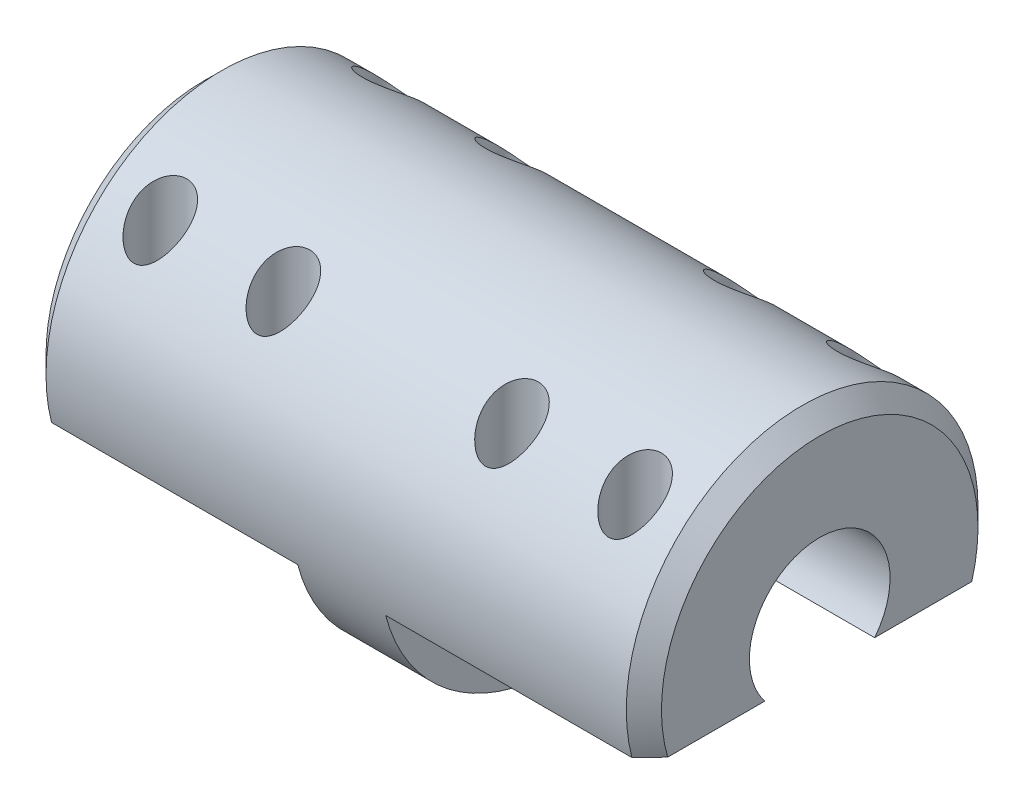
from build123d import *

# Parameters (mm, degrees)
SKETCH_1_R          = 10
SKETCH_1_R_2        = 4
EXTRUDE_1_DEPTH     = 35
CHAMFER_1_SIZE      = 1
SKETCH_3_W          = 15
SKETCH_3_H          = 20
CUT_EXTRUDE_1_DEPTH = 7.5
SKETCH_3_4_R        = 1.5
CUT_EXTRUDE_2_DEPTH = 42.533119315


with BuildPart() as part:
    # 草图1 → 凸台-拉伸1 (new body)
    with BuildSketch(Plane(origin=(0, 0, 0), x_dir=(0, 0, -1), z_dir=(1, 0, 0))):
        Circle(SKETCH_1_R)
        Circle(SKETCH_1_R_2, mode=Mode.SUBTRACT)
    extrude(amount=EXTRUDE_1_DEPTH)

    # 倒角1
    chamfer_1_edges = [part.edges().sort_by_distance(p)[0] for p in [
        (35, 0, 10),
        (0, 0, 10),
    ]]
    chamfer(chamfer_1_edges, length=CHAMFER_1_SIZE)

    # 草图3 → 切除-拉伸1 (cut)
    with BuildSketch(Plane(origin=(0, -10, 0), x_dir=(-1, 0, 0), z_dir=(0, -1, 0))):
        with Locations((-7.5, 0)):
            Rectangle(SKETCH_3_W, SKETCH_3_H)
        with Locations((-27.5, 0)):
            Rectangle(SKETCH_3_W, SKETCH_3_H)
    extrude(amount=-CUT_EXTRUDE_1_DEPTH, mode=Mode.SUBTRACT)

    # 草图3<4> → 切除-拉伸2 (cut, through all)
    with BuildSketch(Plane(origin=(0, -10, 0), x_dir=(-1, 0, 0), z_dir=(0, -1, 0))):
        with Locations((-4, 6.5)):
            Circle(SKETCH_3_4_R)
        with Locations((-11, 6.5)):
            Circle(SKETCH_3_4_R)
        with Locations((-11, -6.5)):
            Circle(SKETCH_3_4_R)
        with Locations((-4, -6.5)):
            Circle(SKETCH_3_4_R)
        with Locations((-31, -6.5)):
            Circle(SKETCH_3_4_R)
        with Locations((-24, -6.5)):
            Circle(SKETCH_3_4_R)
        with Locations((-24, 6.5)):
            Circle(SKETCH_3_4_R)
        with Locations((-31, 6.5)):
            Circle(SKETCH_3_4_R)
    extrude(amount=-CUT_EXTRUDE_2_DEPTH, mode=Mode.SUBTRACT)


solid = part.part
